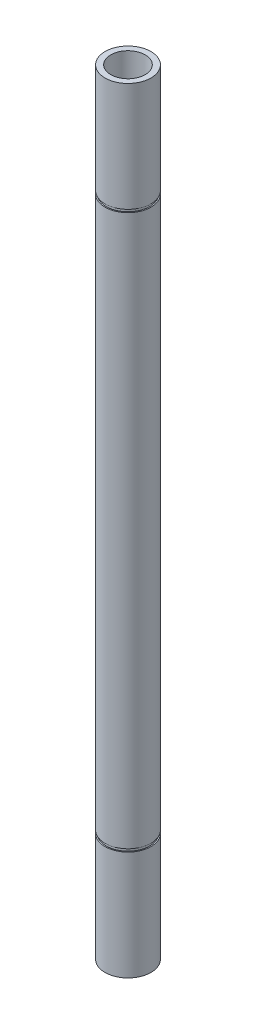
from build123d import *


with BuildPart() as part:
    # Sketch1 → Revolve2 (revolve)
    with BuildSketch(Plane.XY, mode=Mode.PRIVATE) as revolve2_sk:
        Polygon((-3, 67.5), (-4, 67.5), (-4, 48.5), (-3.8, 48.5), (-3.8, 48), (-4, 48), (-4, -48), (-3.8, -48), (-3.8, -48.5), (-4, -48.5), (-4, -67.5), (-3, -67.5), align=None)
    revolve(revolve2_sk.sketch.rotate(Axis((0, 64.302267184, 0), (0, -1, 0)), 270), axis=Axis((0, 64.302267184, 0), (0, -1, 0)))


solid = part.part
